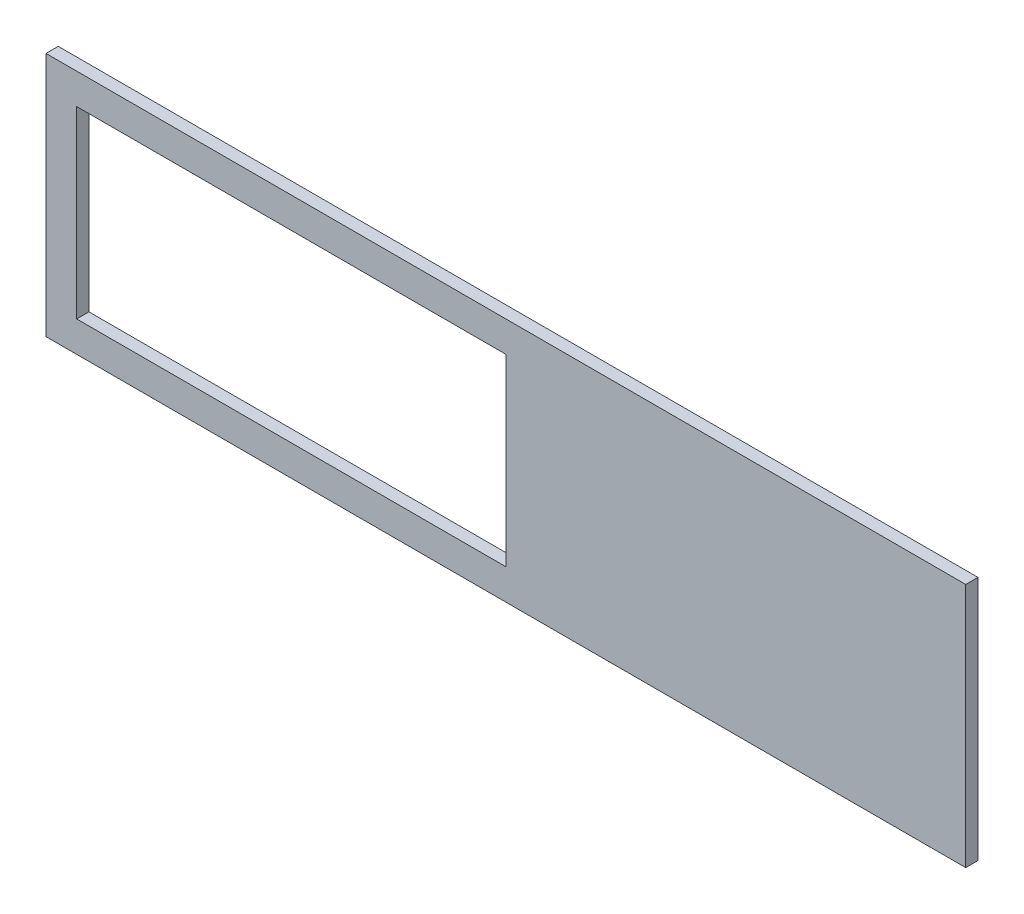
from build123d import *

# Parameters (mm, degrees)
CROQUIS1_W              = 300
CROQUIS1_H              = 80
CROQUIS1_W_2            = 140
CROQUIS1_H_2            = 60
SALIENTE_EXTRUIR1_DEPTH = 4


with BuildPart() as part:
    # Croquis1 → Saliente-Extruir1 (new body)
    with BuildSketch(Plane.XY):
        with Locations((150, 40)):
            Rectangle(CROQUIS1_W, CROQUIS1_H)
        with Locations((80, 40)):
            Rectangle(CROQUIS1_W_2, CROQUIS1_H_2, mode=Mode.SUBTRACT)
    extrude(amount=SALIENTE_EXTRUIR1_DEPTH)


solid = part.part
